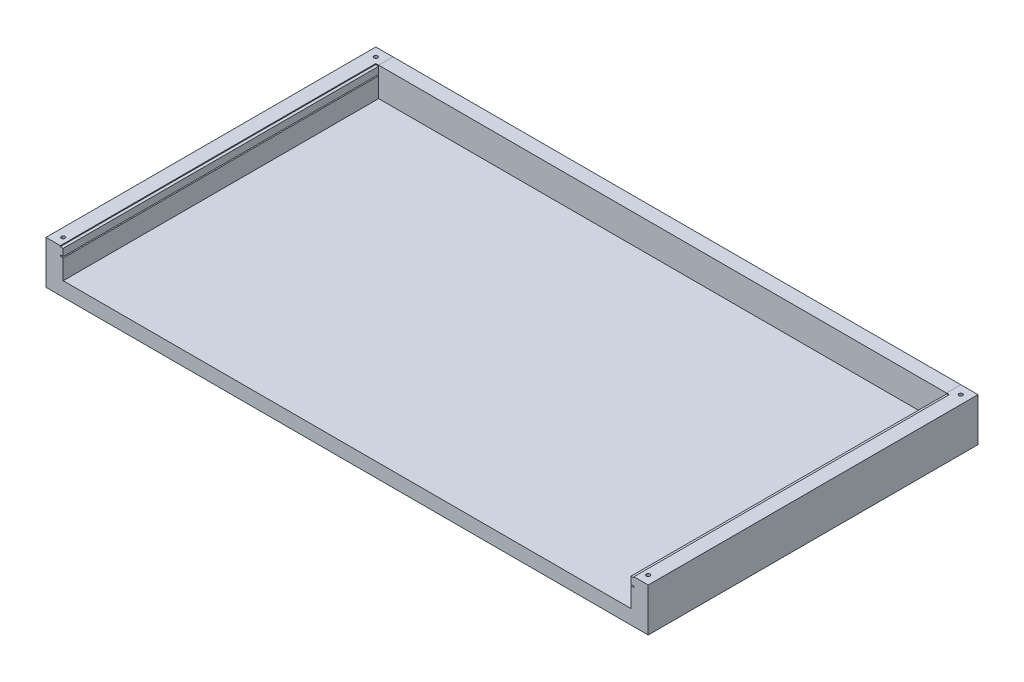
from build123d import *

# Parameters (mm, degrees)
BOSS_EXTRUDE1_DEPTH = 1150
SKETCH4_W           = 1980
SKETCH4_H           = 50
BOSS_EXTRUDE2_DEPTH = 151.05
CUT_EXTRUDE2_START  = 1150
SKETCH6_W           = 2000
SKETCH6_H           = 3.2
SKETCH6_H_2         = 4.2
CUT_EXTRUDE2_DEPTH  = 1100
CUT_EXTRUDE3_START  = 151.05
SKETCH7_R           = 6.35
CUT_EXTRUDE3_DEPTH  = 1716.599808252


with BuildPart() as part:
    # Sketch3 → Boss-Extrude1 (new body)
    with BuildSketch(Plane.XY):
        Polygon((-990, 50), (990, 50), (990, 151.05), (1050, 151.05), (1050, 0), (-1050, 0), (-1050, 151.05), (-990, 151.05), align=None)
    extrude(amount=BOSS_EXTRUDE1_DEPTH)

    # Sketch6 → Cut-Extrude2 (cut)
    with BuildSketch(Plane.XY.offset(CUT_EXTRUDE2_START)):
        with Locations((0, 149.45)):
            Rectangle(SKETCH6_W, SKETCH6_H)
        with Locations((0, 120.95)):
            Rectangle(SKETCH6_W, SKETCH6_H_2)
    extrude(amount=-CUT_EXTRUDE2_DEPTH, mode=Mode.SUBTRACT)

    # Sketch7 → Cut-Extrude3 (cut, through all)
    with BuildSketch(Plane(origin=(0, 0, 0), x_dir=(1, 0, 0), z_dir=(0, 1, 0)).offset(CUT_EXTRUDE3_START)):
        with Locations(Location((1020, -30, 0), (0, 0, 90))):
            Circle(SKETCH7_R)
        with Locations(Location((-1020, -30, 0), (0, 0, 90))):
            Circle(SKETCH7_R)
        with Locations(Location((-1020, -1120, 0), (0, 0, 90))):
            Circle(SKETCH7_R)
        with Locations(Location((1020, -1120, 0), (0, 0, 90))):
            Circle(SKETCH7_R)
    extrude(amount=-CUT_EXTRUDE3_DEPTH, mode=Mode.SUBTRACT)


with BuildPart() as body_2:
    # Sketch4 → Boss-Extrude2 (new body)
    with BuildSketch(Plane(origin=(0, 0, 0), x_dir=(1, 0, 0), z_dir=(0, 1, 0))):
        with Locations((0, -25)):
            Rectangle(SKETCH4_W, SKETCH4_H)
    extrude(amount=BOSS_EXTRUDE2_DEPTH)


solid = Compound([part.part, body_2.part])
